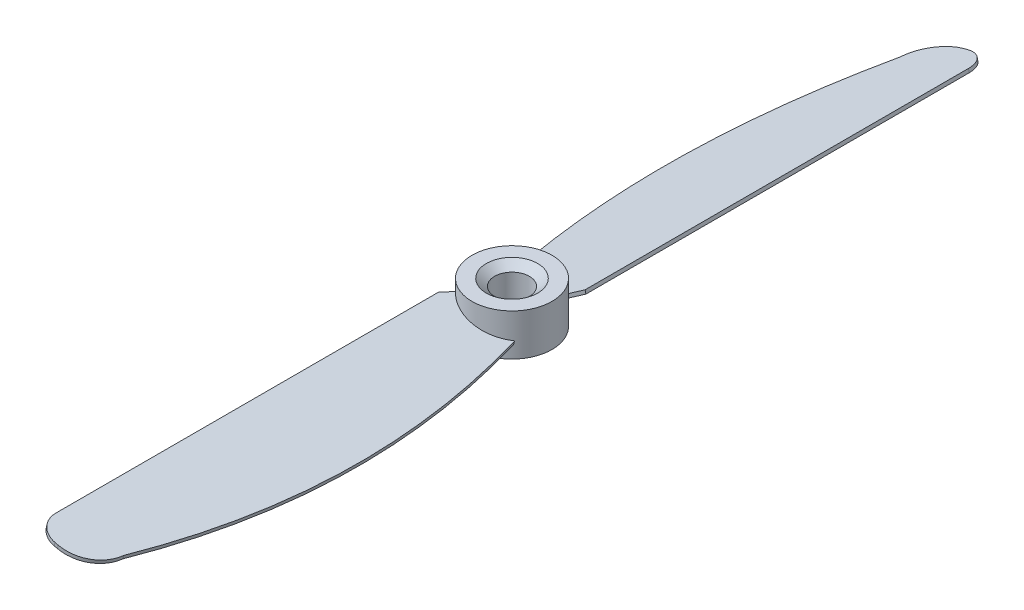
from build123d import *
from OCP.BRepFilletAPI import BRepFilletAPI_MakeChamfer

# Parameters (mm, degrees)
SKETCH_1_R               = 5.75
EXTRUDE_1_DEPTH          = 3
EXTRUDE_2_DEPTH          = 0.25
PATTERN_CIRCULAR_1_COUNT = 2
SKETCH_4_R               = 2.5
CUT_EXTRUDE_1_DEPTH      = 65.222479954
CHAMFER_1_SIZE           = 1
CHAMFER_1_SIZE2          = 1.191753593


with BuildPart() as part:
    # 草图1 → 凸台-拉伸1 (new, symmetric)
    with BuildSketch(Plane(origin=(0, 0, 0), x_dir=(1, 0, 0), z_dir=(0, 1, 0))):
        with Locations(Location((0, 0, 0), (0, 0, 270))):
            Circle(SKETCH_1_R)
    extrude(amount=EXTRUDE_1_DEPTH, both=True)

    # 草图3 → 凸台-拉伸2 (add, symmetric)
    with BuildSketch(Plane(origin=(0, 0, 0), x_dir=(0.9743700647852351, -0.22495105434386545, 0), z_dir=(-0.22495105434386545, -0.9743700647852351, 0))):
        with BuildLine():
            Line((-3.916367875, 3.295399757), (-5.31388764, 5.389585316))
            Line((-5.31388764, 5.389585316), (-5.31388764, 60.5))
            ThreePointArc((-5.31388764, 60.5), (-4.435207984, 62.621320344), (-2.31388764, 63.5))
            Line((-2.31388764, 63.5), (-1.829824276, 63.5))
            ThreePointArc((-1.829824276, 63.5), (1.545488809, 62.188802187), (3.15052064, 58.942904631))
            add(Edge.make_bspline(
                [(3.15052064, 58.942904631), (11.816057199, 30.493674225), (3.76071755, 1.848135525)],
                knots=[0, 0, 0, 1, 1, 1], degree=2))
            add(Edge.make_bspline(
                [(-3.916367875, 3.295399757), (0.478704758, 7.563280094), (3.76071755, 1.848135525)],
                knots=[0, 0, 0, 1, 1, 1], degree=2))
        make_face()
    extrude_2 = extrude(amount=EXTRUDE_2_DEPTH, both=True)

    # 阵列(圆周)1: 凸台-拉伸2 ×2 about axis
    pattern_circular_1_axis = Axis((0, -3, 0), (0, 1, 0))
    for i in range(1, PATTERN_CIRCULAR_1_COUNT):
        add(extrude_2.rotate(pattern_circular_1_axis, i * 360 / PATTERN_CIRCULAR_1_COUNT))

    # 草图4 → 切除-拉伸1 (cut, through all)
    with BuildSketch(Plane.XZ.offset(3)):
        with Locations(Location((0, 0, 0), (0, 0, 270))):
            Circle(SKETCH_4_R)
    extrude(amount=-CUT_EXTRUDE_1_DEPTH, mode=Mode.SUBTRACT)

    # 倒角1: one chamfer whose edges measure the first distance from different faces: ONE call of the kernel's chamfer builder (chamfer() names one face for all edges)
    chamfer_1_edges_1 = [part.edges().sort_by_distance(p)[0] for p in [
        (0, 3, 2.5),
    ]]
    chamfer_1_side_1 = [part.faces().sort_by_distance(p)[0] for p in [
        (0, 0, 2.5),
    ]]
    chamfer_1_edges_2 = [part.edges().sort_by_distance(p)[0] for p in [
        (0, -3, 2.5),
    ]]
    chamfer_1_side_2 = [part.faces().sort_by_distance(p)[0] for p in [
        (0, -3, -5.58736544),
    ]]
    chamfer_1 = BRepFilletAPI_MakeChamfer(part.part.solid().wrapped)
    for e in chamfer_1_edges_1:
        chamfer_1.Add(CHAMFER_1_SIZE, CHAMFER_1_SIZE2, e.wrapped, chamfer_1_side_1[0].wrapped)  # the first distance lies on this face
    for e in chamfer_1_edges_2:
        chamfer_1.Add(CHAMFER_1_SIZE, CHAMFER_1_SIZE2, e.wrapped, chamfer_1_side_2[0].wrapped)  # the first distance lies on this face
    add(Compound.cast(chamfer_1.Shape()), mode=Mode.REPLACE)


solid = part.part
